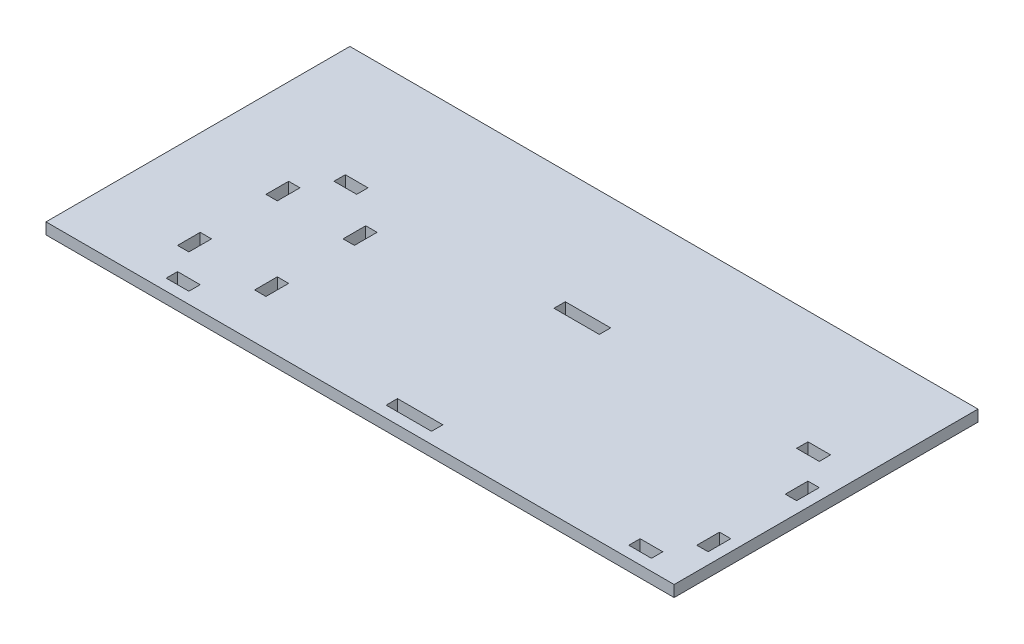
from build123d import *

# Parameters (mm, degrees)
SKETCH_1_W      = 10
SKETCH_1_H      = 5
SKETCH_1_W_2    = 20
SKETCH_1_W_3    = 5
SKETCH_1_H_2    = 10
EXTRUDE_1_DEPTH = 5


with BuildPart() as part:
    # 草图1 → 凸台-拉伸1 (new body)
    with BuildSketch(Plane(origin=(0, 0, 0), x_dir=(1, 0, 0), z_dir=(0, 1, 0))):
        Polygon((-195.058737628, 90.053763441), (76.941262372, 90.053763441), (81.941262372, 90.053763441), (81.941262372, -43.946236559), (76.941262372, -43.946236559), (-195.058737628, -43.946236559), align=None)
        with Locations((61.941262372, 37.553763441)):
            Rectangle(SKETCH_1_W, SKETCH_1_H, mode=Mode.SUBTRACT)
        with Locations((-142.058737628, 37.553763441)):
            Rectangle(SKETCH_1_W, SKETCH_1_H, mode=Mode.SUBTRACT)
        with Locations((-142.058737628, -36.446236559)):
            Rectangle(SKETCH_1_W, SKETCH_1_H, mode=Mode.SUBTRACT)
        with Locations((61.941262372, -36.446236559)):
            Rectangle(SKETCH_1_W, SKETCH_1_H, mode=Mode.SUBTRACT)
        with Locations((-40.058737628, 37.553763441)):
            Rectangle(SKETCH_1_W_2, SKETCH_1_H, mode=Mode.SUBTRACT)
        with Locations((-154.558737628, 20.053763441)):
            Rectangle(SKETCH_1_W_3, SKETCH_1_H_2, mode=Mode.SUBTRACT)
        with Locations((-154.558737628, -18.946236559)):
            Rectangle(SKETCH_1_W_3, SKETCH_1_H_2, mode=Mode.SUBTRACT)
        with Locations((74.441262372, 20.053763441)):
            Rectangle(SKETCH_1_W_3, SKETCH_1_H_2, mode=Mode.SUBTRACT)
        with Locations((74.441262372, -18.946236559)):
            Rectangle(SKETCH_1_W_3, SKETCH_1_H_2, mode=Mode.SUBTRACT)
        with Locations((-40.058737628, -36.446236559)):
            Rectangle(SKETCH_1_W_2, SKETCH_1_H, mode=Mode.SUBTRACT)
        with Locations((-120.558737628, 20.053763441)):
            Rectangle(SKETCH_1_W_3, SKETCH_1_H_2, mode=Mode.SUBTRACT)
        with Locations((-120.558737628, -18.946236559)):
            Rectangle(SKETCH_1_W_3, SKETCH_1_H_2, mode=Mode.SUBTRACT)
    extrude(amount=EXTRUDE_1_DEPTH)


solid = part.part
